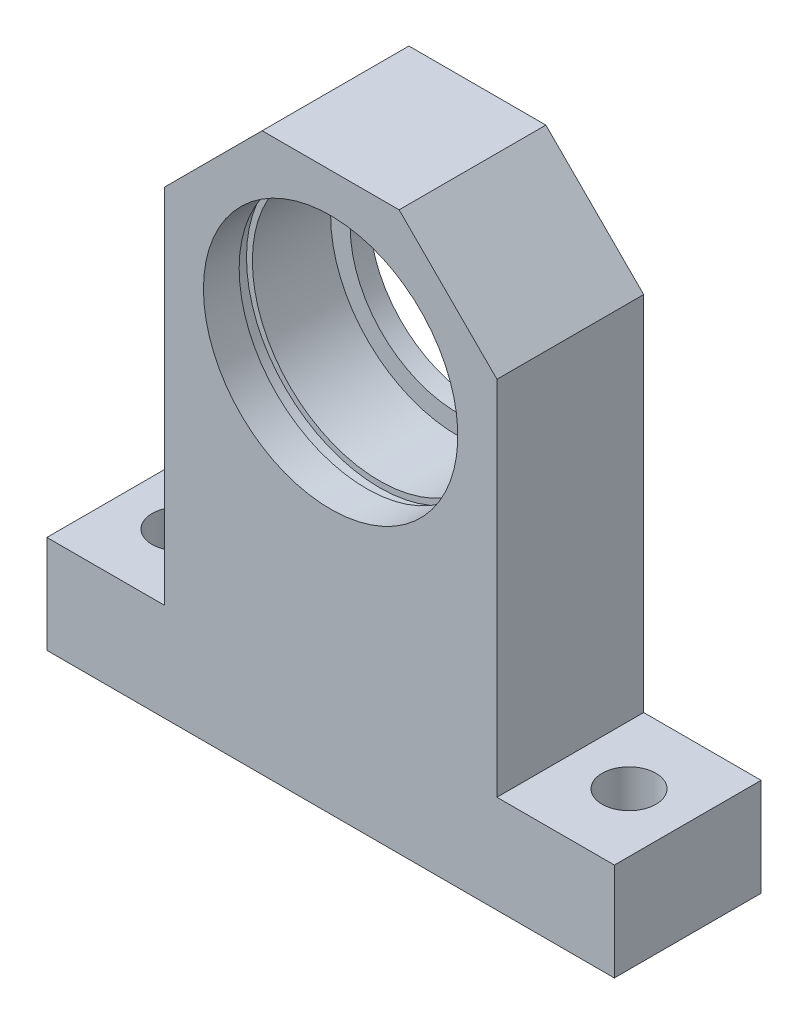
from build123d import *

# Parameters (mm, degrees)
BOSS_EXTRUDE1_DEPTH = 15
DIAMETER_HOLE1_D    = 5.5
CHAMFER1_SIZE       = 10


with BuildPart() as part:
    # Sketch1 → Boss-Extrude1 (new body)
    with BuildSketch(Plane.XY):
        Polygon((-17, 57), (17, 57), (17, 10), (29, 10), (29, 0), (-29, 0), (-29, 10), (-17, 10), align=None)
    extrude(amount=-BOSS_EXTRUDE1_DEPTH)

    # Sketch2 → Cut-Revolve1 (revolve, cut)
    with BuildSketch(Plane(origin=(0, 0, 0), x_dir=(0, 0, -1), z_dir=(1, 0, 0))):
        Polygon((3.65, 53), (3.65, 53.6), (5, 53.6), (5, 53), (13, 53), (13, 51), (15, 51), (15, 40), (0, 40), (0, 53), align=None)
    revolve(axis=Axis((0, 40, -15), (0, 0, 1)), mode=Mode.SUBTRACT)

    # Diameter Hole1 (through all)
    with Locations(Plane(origin=(0, 10, 0), x_dir=(1, 0, 0), z_dir=(0, 1, 0))):
        with Locations((-23, 7.5), (23, 7.5)):
            Hole(DIAMETER_HOLE1_D / 2)

    # Chamfer1
    chamfer1_edges = [part.edges().sort_by_distance(p)[0] for p in [
        (-17, 57, -7.5),
        (17, 57, -7.5),
    ]]
    chamfer(chamfer1_edges, length=CHAMFER1_SIZE)


solid = part.part
